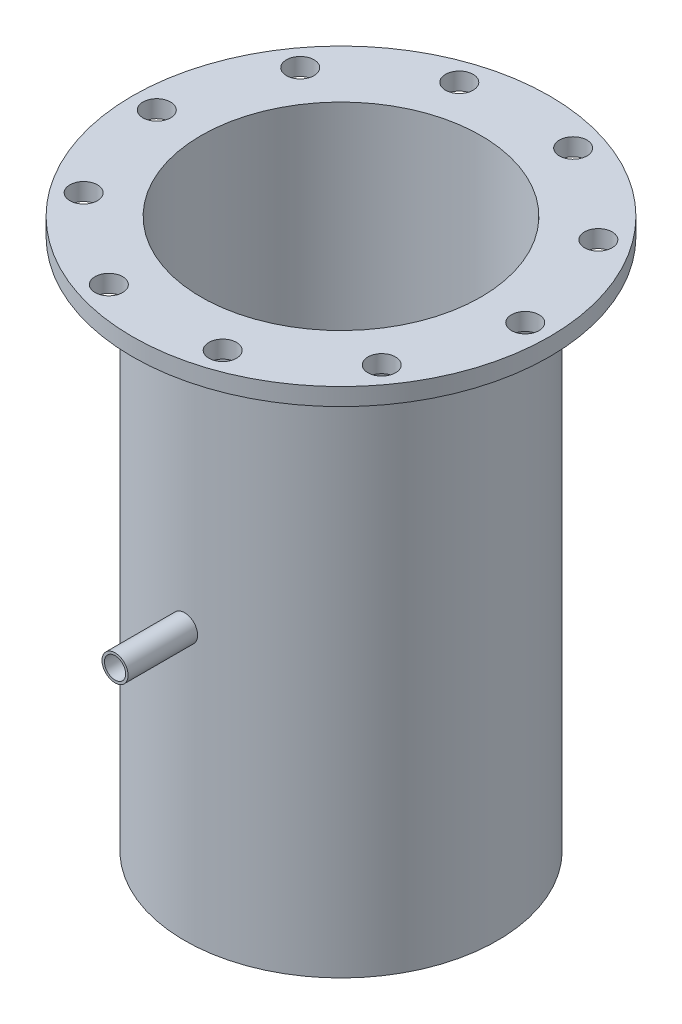
from build123d import *

# Parameters (mm, degrees)
TAP_DRILL_FOR_3_8_16_TAP1_D = 10.0838
CIRPATTERN1_COUNT           = 10
SKETCH4_R                   = 4.7625
SKETCH4_R_2                 = 3.8735
BOSS_EXTRUDE1_DEPTH         = 25.4


with BuildPart() as part:
    # Sketch1 → Revolve1 (revolve)
    with BuildSketch(Plane.XY, mode=Mode.PRIVATE) as revolve1_sk:
        Polygon((51.1302, 0), (51.1302, -188.026963516), (53.848, -188.026963516), (53.848, -191.074963516), (51.1302, -191.074963516), (51.1302, -200.599963516), (57.15, -200.599963516), (57.15, -8.89), (54.61, -6.35), (76.2, -6.35), (76.2, 0), align=None)
    revolve(revolve1_sk.sketch.rotate(Axis((0, 0, 0), (0, -1, 0)), 180), axis=Axis((0, 0, 0), (0, -1, 0)))

    # Tap Drill for 3/8-16 Tap1 (through all)
    with Locations(Plane(origin=(0, 0, 0), x_dir=(1, 0, 0), z_dir=(0, 1, 0))):
        with Locations((67.31, 0)):
            tap_drill_for_3_8_16_tap1 = Hole(TAP_DRILL_FOR_3_8_16_TAP1_D / 2)

    # CirPattern1: Tap Drill for 3/8-16 Tap1 ×10 about axis
    cirpattern1_axis = Axis((0, 0, 0), (0, 1, 0))
    for i in range(1, CIRPATTERN1_COUNT):
        add(tap_drill_for_3_8_16_tap1.rotate(cirpattern1_axis, i * 360 / CIRPATTERN1_COUNT), mode=Mode.SUBTRACT)

    # Sketch11 → 1/8 (0.125) Diameter Hole3 (revolve, cut)
    with BuildSketch(Plane(origin=(0, -101.6, 57.15), x_dir=(0, -1, 0), z_dir=(1, 0, 0))):
        Polygon((0, 0), (0, 26.353866233), (1.5875, 25.4), (1.5875, 0), align=None)
    revolve(axis=Axis((0, -101.6, 63.5), (0, 0, -1)), mode=Mode.SUBTRACT)


with BuildPart() as body_2:
    # Sketch4 → Boss-Extrude1 (new body)
    with BuildSketch(Plane.XY.offset(57.15)):
        with Locations((0, -101.6)):
            Circle(SKETCH4_R)
        with Locations((0, -101.6)):
            Circle(SKETCH4_R_2, mode=Mode.SUBTRACT)
    extrude(amount=BOSS_EXTRUDE1_DEPTH)


solid = Compound([part.part, body_2.part])
